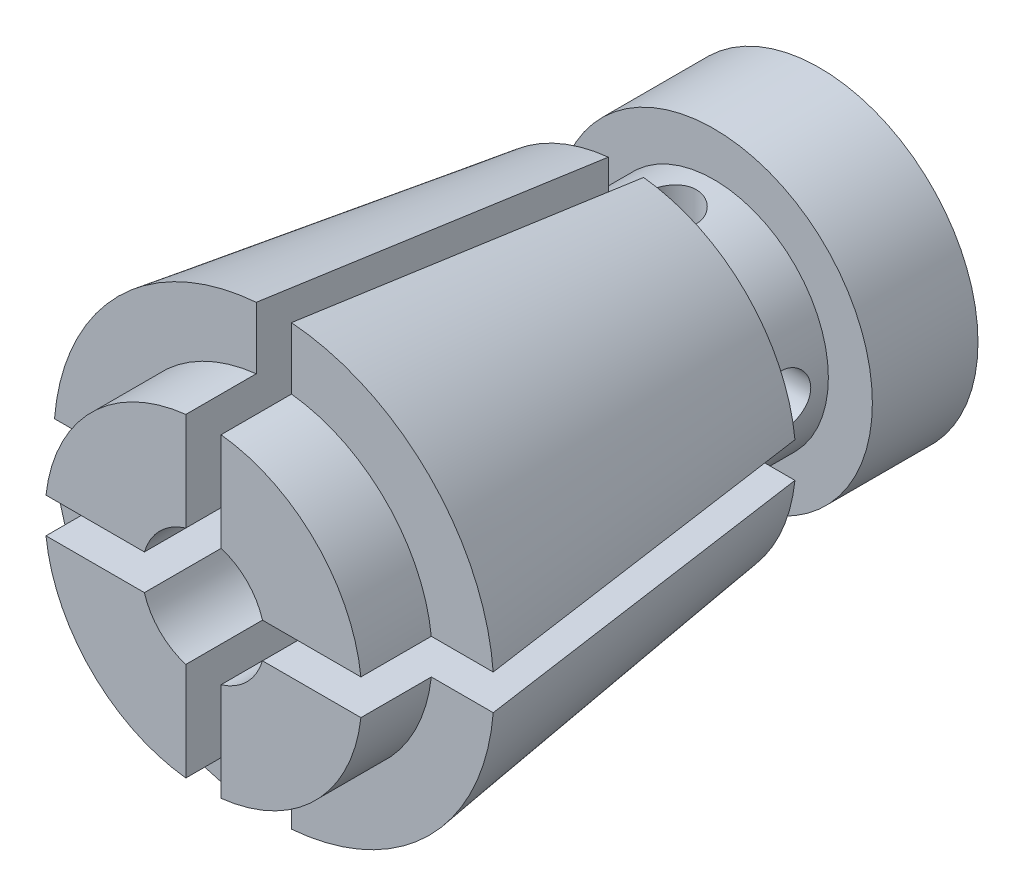
from build123d import *

# Parameters (mm, degrees)
SKETCH_2_R               = 1.5
CUT_EXTRUDE_1_DEPTH      = 10
PATTERN_CIRCULAR_1_COUNT = 4
CUT_EXTRUDE_3_REACH      = 41.211
SKETCH_3_R               = 3.5
CUT_EXTRUDE_4_REACH      = 41.211
CUT_EXTRUDE_4_END_RADIUS = 1.5
SKETCH_4_W               = 31.367872694
SKETCH_4_H               = 2
CUT_EXTRUDE_START        = -24
SKETCH_5_W               = 2
SKETCH_5_H               = 28.424190946
CUT_EXTRUDE_5_DEPTH      = 24


with BuildPart() as part:
    # 草图1 → 旋转1 (revolve)
    with BuildSketch(Plane(origin=(0, 0, 0), x_dir=(0, 0, -1), z_dir=(1, 0, 0)), mode=Mode.PRIVATE) as revolve_1_sk:
        Polygon((-2.5, 6.5), (2.5, 6.5), (2.5, 9), (8.5, 9), (8.5, 0), (-26.5, 0), (-26.5, 9), (-22.5, 9), (-22.5, 12.5), (-2.5, 9.653578486), align=None)
    revolve(revolve_1_sk.sketch.rotate(Axis((0, 0, 115.12599891), (0, 0, -1)), 90), axis=Axis((0, 0, 115.12599891), (0, 0, -1)))

    # 草图2 → 切除-拉伸1 (cut)
    with BuildSketch(Plane(origin=(0, 0, 0), x_dir=(1, 0, 0), z_dir=(0, 1, 0))):
        with Locations(Location((0, 0, 0), (0, 0, 270))):
            Circle(SKETCH_2_R)
    cut_extrude_1 = extrude(amount=-CUT_EXTRUDE_1_DEPTH, mode=Mode.SUBTRACT)

    # 阵列(圆周)1: 切除-拉伸1 ×4 about axis
    pattern_circular_1_axis = Axis((0, 0, 2.5), (0, 0, 1))
    for i in range(1, PATTERN_CIRCULAR_1_COUNT):
        add(cut_extrude_1.rotate(pattern_circular_1_axis, i * 360 / PATTERN_CIRCULAR_1_COUNT), mode=Mode.SUBTRACT)

    # 草图3 → 切除-拉伸3 (cut, up to next)
    with BuildSketch(Plane(origin=(0, 0, -8.5), x_dir=(-1, 0, 0), z_dir=(0, 0, -1)), mode=Mode.PRIVATE) as cut_extrude_3_sk1:
        Circle(SKETCH_3_R)
    cut_extrude_3_tool1 = extrude(cut_extrude_3_sk1.sketch, amount=-CUT_EXTRUDE_3_REACH, mode=Mode.PRIVATE) & part.part
    add(cut_extrude_3_tool1.solids().sort_by_distance((0, 0, -8.5))[0], mode=Mode.SUBTRACT)

    # 切除-拉伸4: up to this cylinder (the profile starts outside it)
    cut_extrude_4_end = Plane(origin=(0, 0, 0), z_dir=(-1, 0, 0)) * Cylinder(CUT_EXTRUDE_4_END_RADIUS, 86.422, mode=Mode.PRIVATE)
    # 草图4 → 切除-拉伸4 (cut, up to the surface)
    with BuildSketch(Plane.XY.offset(26.5), mode=Mode.PRIVATE) as cut_extrude_4_sk1:
        Rectangle(SKETCH_4_W, SKETCH_4_H)
    cut_extrude_4_tool1 = extrude(cut_extrude_4_sk1.sketch, amount=-CUT_EXTRUDE_4_REACH, mode=Mode.PRIVATE) - cut_extrude_4_end
    add(cut_extrude_4_tool1.solids().sort_by_distance((0, 0, 26.5))[0], mode=Mode.SUBTRACT)

    # 草图5 → 切除-拉伸5 (cut)
    with BuildSketch(Plane.XY.offset(26.5).offset(CUT_EXTRUDE_START)):
        Rectangle(SKETCH_5_W, SKETCH_5_H)
    extrude(amount=CUT_EXTRUDE_5_DEPTH, mode=Mode.SUBTRACT)


solid = part.part
